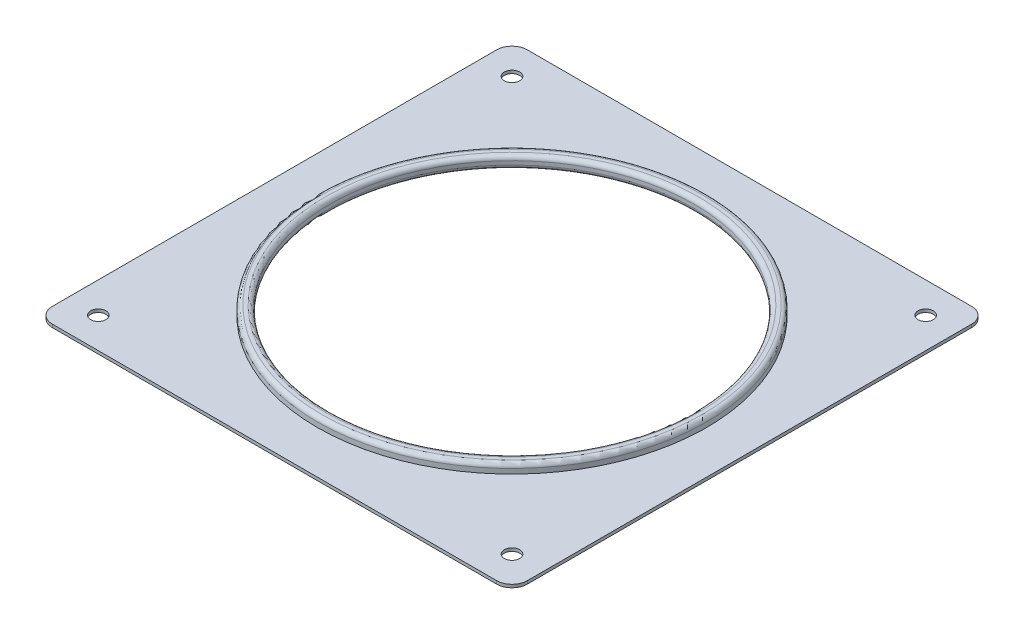
from build123d import *

# Parameters (mm, degrees)
SKETCH1_R           = 59.5
SKETCH1_R_2         = 2.5
BOSS_EXTRUDE1_DEPTH = 1
SKETCH2_R           = 63.5
SKETCH2_R_2         = 59.5
BOSS_EXTRUDE2_DEPTH = 3
FILLET1_R           = 1.4
FILLET2_R           = 1.4


with BuildPart() as part:
    # Sketch1 → Boss-Extrude1 (new body)
    with BuildSketch(Plane(origin=(0, 0, 0), x_dir=(1, 0, 0), z_dir=(0, 1, 0))):
        with BuildLine():
            Line((-72.5, -77.5), (72.5, -77.5))
            ThreePointArc((72.5, -77.5), (76.035533906, -76.035533906), (77.5, -72.5))
            Line((77.5, -72.5), (77.5, 72.5))
            ThreePointArc((77.5, 72.5), (76.035533906, 76.035533906), (72.5, 77.5))
            Line((72.5, 77.5), (-72.5, 77.5))
            ThreePointArc((-72.5, 77.5), (-76.035533906, 76.035533906), (-77.5, 72.5))
            Line((-77.5, 72.5), (-77.5, -72.5))
            ThreePointArc((-77.5, -72.5), (-76.035533906, -76.035533906), (-72.5, -77.5))
        make_face()
        with Locations(Location((0, 0, 0), (0, 0, 270))):
            Circle(SKETCH1_R, mode=Mode.SUBTRACT)
        with Locations(Location((-67.5, 67.5, 0), (0, 0, 270))):
            Circle(SKETCH1_R_2, mode=Mode.SUBTRACT)
        with Locations(Location((67.5, 67.5, 0), (0, 0, 270))):
            Circle(SKETCH1_R_2, mode=Mode.SUBTRACT)
        with Locations(Location((67.5, -67.5, 0), (0, 0, 270))):
            Circle(SKETCH1_R_2, mode=Mode.SUBTRACT)
        with Locations(Location((-67.5, -67.5, 0), (0, 0, 270))):
            Circle(SKETCH1_R_2, mode=Mode.SUBTRACT)
    extrude(amount=BOSS_EXTRUDE1_DEPTH)

    # Sketch2 → Boss-Extrude2 (add)
    with BuildSketch(Plane(origin=(0, 1, 0), x_dir=(1, 0, 0), z_dir=(0, 1, 0))):
        with Locations(Location((0, 0, 0), (0, 0, 270))):
            Circle(SKETCH2_R)
        with Locations(Location((0, 0, 0), (0, 0, 270))):
            Circle(SKETCH2_R_2, mode=Mode.SUBTRACT)
    extrude(amount=BOSS_EXTRUDE2_DEPTH)

    # Fillet1
    fillet1_edges = [part.edges().sort_by_distance(p)[0] for p in [
        (0, 4, -63.5),
        (0, 4, -59.5),
    ]]
    fillet(fillet1_edges, radius=FILLET1_R)

    # Fillet2
    fillet2_edges = [part.edges().sort_by_distance(p)[0] for p in [
        (0, 0, -59.5),
    ]]
    fillet(fillet2_edges, radius=FILLET2_R)


solid = part.part
